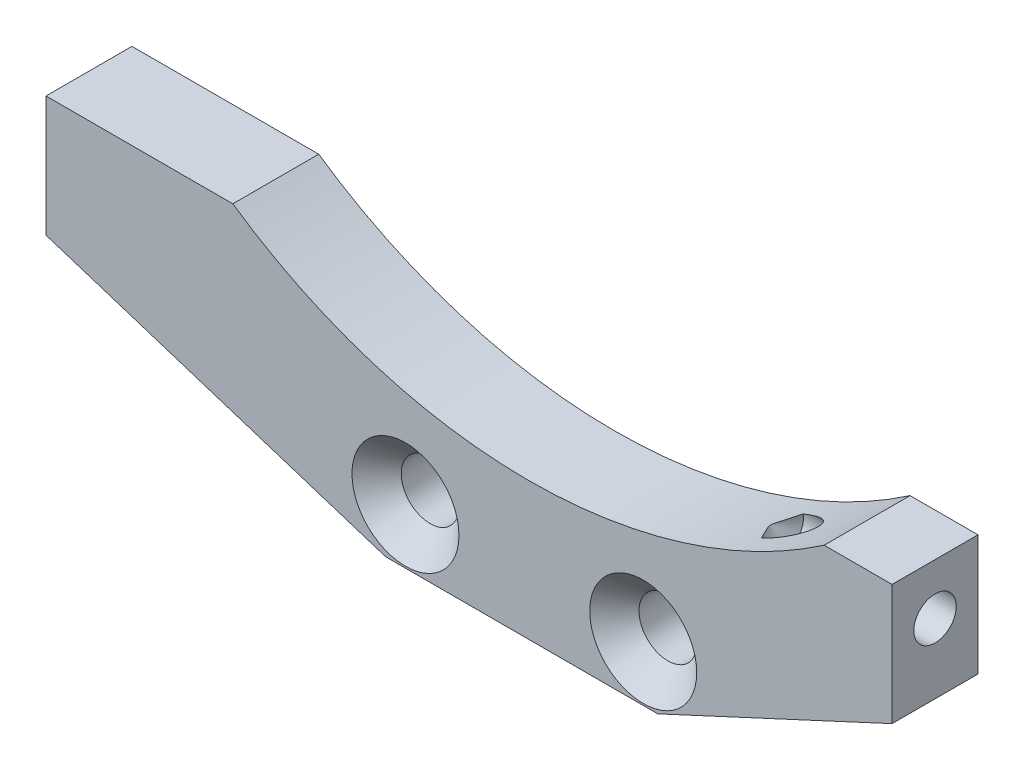
from build123d import *

# Parameters (mm, degrees)
ESTRUSIONE_ESTRUSIONE1_DEPTH           = 5.06
FORO_SVASATO_PER_VITE_M3_2_D           = 3.4
FORO_SVASATO_PER_VITE_M3_2_CSINK_D     = 6.3
FORO_SVASATO_PER_VITE_M3_2_CSINK_ANGLE = 90


with BuildPart() as part:
    # Schizzo4 → Estrusione-Estrusione1 (new body)
    with BuildSketch(Plane.XY):
        with BuildLine():
            Line((-20, 6.4), (0, 0))
            Line((0, 0), (16.02, 0))
            Line((16.02, 0), (29.82, 6.4))
            Line((29.82, 6.4), (29.82, 13.5))
            Line((29.82, 13.5), (25.82, 13.5))
            ThreePointArc((25.82, 13.5), (8.41, 8.1), (-9, 13.5))
            Line((-9, 13.5), (-20, 13.5))
            Line((-20, 13.5), (-20, 6.4))
        make_face()
    extrude(amount=ESTRUSIONE_ESTRUSIONE1_DEPTH)

    # Schizzo7 → Foro filettato M3x0.5-1 (revolve, cut)
    with BuildSketch(Plane(origin=(-20, 10.5, 2.53), x_dir=(0, 0, 1), z_dir=(0, 1, 0))):
        Polygon((0, 0), (0, 9.751075774), (1.25, 9), (1.25, 0), align=None)
    foro_filettato_m3x0_5_1 = revolve(axis=Axis((-26.35, 10.5, 2.53), (1, 0, 0)), mode=Mode.SUBTRACT)

    # Specchia1: Foro filettato M3x0.5-1 across plane
    add(foro_filettato_m3x0_5_1.mirror(Plane.ZY.offset(-4.91)), mode=Mode.SUBTRACT)

    # Foro svasato per Vite M3-2 (through all)
    with Locations(Plane(origin=(-33.438661509, -29.329137282, 5.06), x_dir=(1, 0, 0), z_dir=(0, 0, 1))):
        with Locations((34.605533153, 32.579137282), (48.605533153, 32.579137282)):
            CounterSinkHole(FORO_SVASATO_PER_VITE_M3_2_D / 2, FORO_SVASATO_PER_VITE_M3_2_CSINK_D / 2, counter_sink_angle=FORO_SVASATO_PER_VITE_M3_2_CSINK_ANGLE)


solid = part.part
